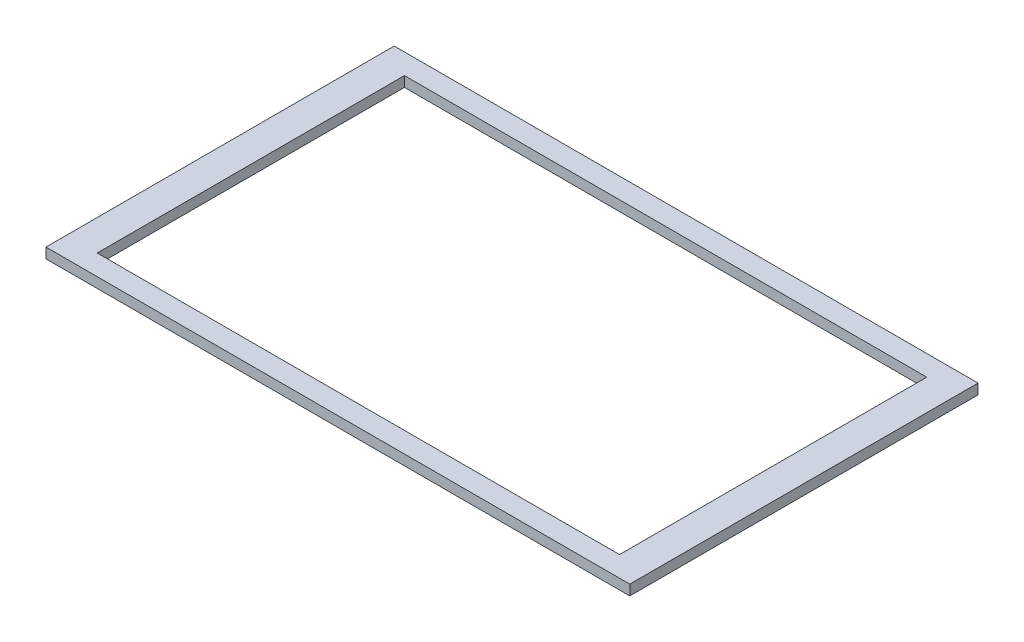
from build123d import *

# Parameters (mm, degrees)
ESBO_O1_W                = 570
ESBO_O1_H                = 340
RESSALTO_EXTRUS_O1_DEPTH = 10
ESBO_O3_W                = 510
ESBO_O3_H                = 300
CORTE_EXTRUS_O1_DEPTH    = 10


with BuildPart() as part:
    # Esboço1 → Ressalto-extrusão1 (new body)
    with BuildSketch(Plane(origin=(0, 0, 0), x_dir=(1, 0, 0), z_dir=(0, 1, 0))):
        Rectangle(ESBO_O1_W, ESBO_O1_H)
    extrude(amount=RESSALTO_EXTRUS_O1_DEPTH)

    # Esboço3 → Corte-extrusão1 (cut)
    with BuildSketch(Plane(origin=(0, 10, 0), x_dir=(1, 0, 0), z_dir=(0, 1, 0))):
        Rectangle(ESBO_O3_W, ESBO_O3_H)
    extrude(amount=-CORTE_EXTRUS_O1_DEPTH, mode=Mode.SUBTRACT)


solid = part.part
